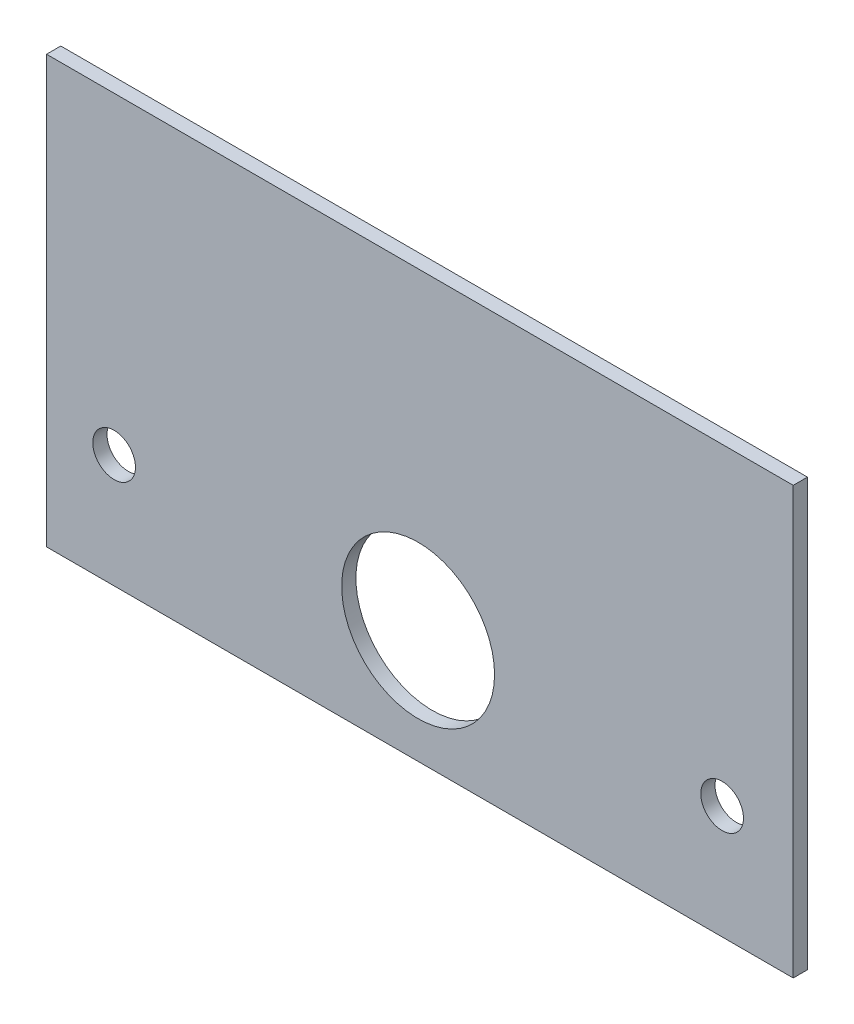
from build123d import *

# Parameters (mm, degrees)
SKETCH1_W           = 105
SKETCH1_H           = 60
SKETCH1_R           = 3
SKETCH1_R_2         = 10.75
BOSS_EXTRUDE1_DEPTH = 2


with BuildPart() as part:
    # Sketch1 → Boss-Extrude1 (new body)
    with BuildSketch(Plane.XY):
        with Locations((-52.5, -30)):
            Rectangle(SKETCH1_W, SKETCH1_H)
        with Locations((-10, -44.05)):
            Circle(SKETCH1_R, mode=Mode.SUBTRACT)
        with Locations((-52.75, -44.05)):
            Circle(SKETCH1_R_2, mode=Mode.SUBTRACT)
        with Locations((-95.5, -44.05)):
            Circle(SKETCH1_R, mode=Mode.SUBTRACT)
    extrude(amount=BOSS_EXTRUDE1_DEPTH)


solid = part.part
